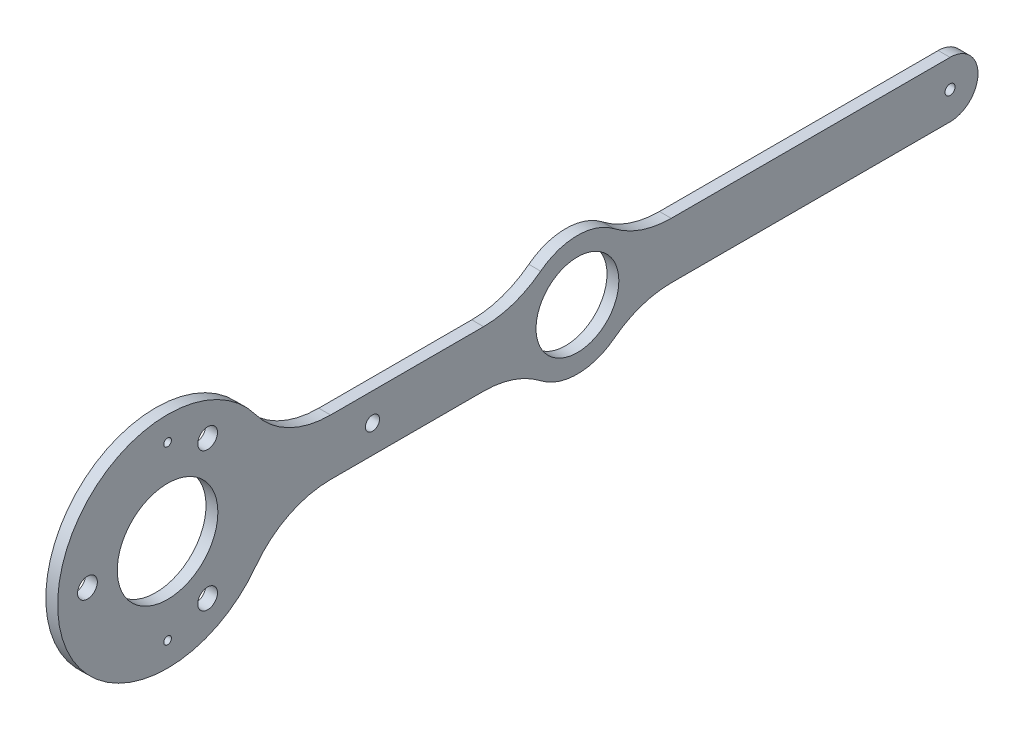
from build123d import *

# Parameters (mm, degrees)
SKETCH1_R                = 13.5
SKETCH1_R_2              = 2.65
SKETCH1_R_3              = 11.1125
BOSS_EXTRUDE1_DEPTH      = 3.175
M2_5X0_45_TAPPED_HOLE1_D = 2.05
F_6_CLEARANCE_HOLE1_D    = 3.7973
F_6_32_TAPPED_HOLE1_D    = 2.7051
FILLET1_R                = 25


with BuildPart() as part:
    # Sketch1 → Boss-Extrude1 (new body)
    with BuildSketch(Plane(origin=(0, 0, 0), x_dir=(0, 0, -1), z_dir=(1, 0, 0))):
        with BuildLine():
            ThreePointArc((-81.469314765, 7.5), (-139.5, 0), (-81.469314765, -7.5))
            Line((-81.469314765, -7.5), (-14.260527909, -7.5))
            ThreePointArc((-14.260527909, -7.5), (0, -16.1125), (14.260527909, -7.5))
            Line((14.260527909, -7.5), (100, -7.5))
            ThreePointArc((100, -7.5), (107.5, 0), (100, 7.5))
            Line((100, 7.5), (14.260527909, 7.5))
            ThreePointArc((14.260527909, 7.5), (0, 16.1125), (-14.260527909, 7.5))
            Line((-14.260527909, 7.5), (-81.469314765, 7.5))
        make_face()
        with Locations((-110, 0)):
            Circle(SKETCH1_R, mode=Mode.SUBTRACT)
        with Locations((-99.25, -18.619546181)):
            Circle(SKETCH1_R_2, mode=Mode.SUBTRACT)
        with Locations((-131.5, 0)):
            Circle(SKETCH1_R_2, mode=Mode.SUBTRACT)
        with Locations((-99.25, 18.619546181)):
            Circle(SKETCH1_R_2, mode=Mode.SUBTRACT)
        Circle(SKETCH1_R_3, mode=Mode.SUBTRACT)
    extrude(amount=BOSS_EXTRUDE1_DEPTH)

    # M2.5x0.45 Tapped Hole1 (through all)
    with Locations(Plane(origin=(3.175, 0, 0), x_dir=(0, 0, -1), z_dir=(1, 0, 0))):
        with Locations((-110, -23.015), (-110, 23.015)):
            Hole(M2_5X0_45_TAPPED_HOLE1_D / 2)

    # #6 Clearance Hole1 (through all)
    with Locations(Plane(origin=(3.175, 0, 0), x_dir=(0, 0, -1), z_dir=(1, 0, 0))):
        with Locations((-55, 0)):
            Hole(F_6_CLEARANCE_HOLE1_D / 2)

    # #6-32 Tapped Hole1 (through all)
    with Locations(Plane(origin=(3.175, 0, 0), x_dir=(0, 0, -1), z_dir=(1, 0, 0))):
        with Locations((100, 0)):
            Hole(F_6_32_TAPPED_HOLE1_D / 2)

    # Fillet1
    fillet1_edges = [part.edges().sort_by_distance(p)[0] for p in [
        (1.5875, 7.5, 81.469314765),
        (1.5875, 7.5, 14.260527909),
        (1.5875, 7.5, -14.260527909),
        (1.5875, -7.5, -14.260527909),
        (1.5875, -7.5, 14.260527909),
        (1.5875, -7.5, 81.469314765),
    ]]
    fillet(fillet1_edges, radius=FILLET1_R)


solid = part.part
